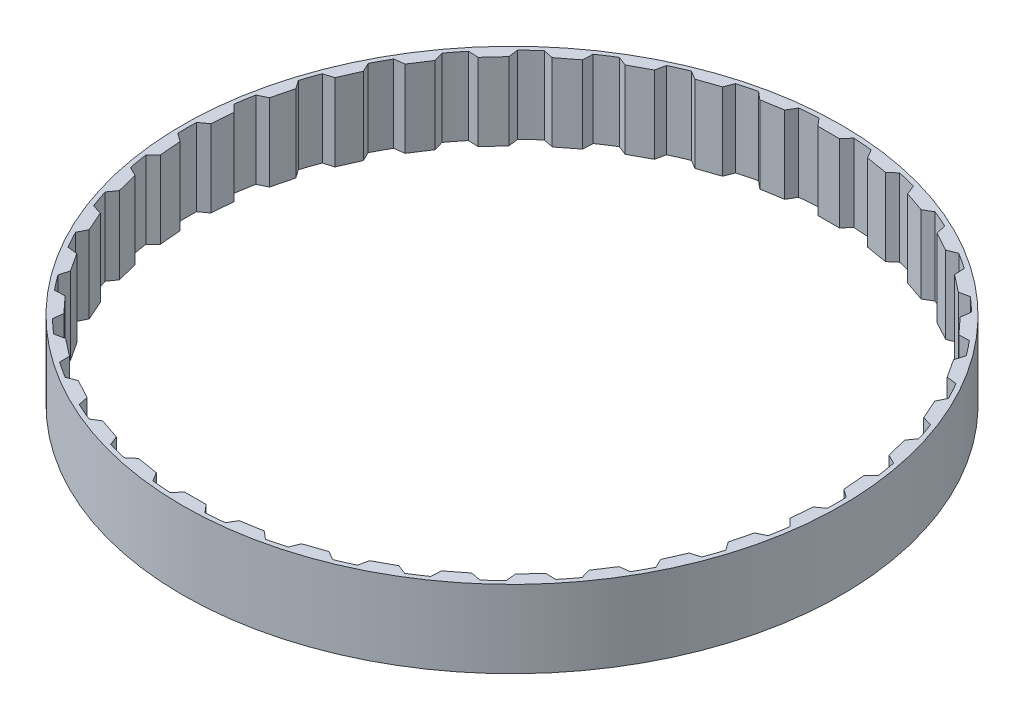
from build123d import *

# Parameters (mm, degrees)
SKETCH_1_R               = 42.6
SKETCH_1_R_2             = 42
EXTRUDE_1_DEPTH          = 10
EXTRUDE_START            = -10
EXTRUDE_2_DEPTH          = 10
PATTERN_CIRCULAR_1_COUNT = 38


with BuildPart() as part:
    # 草图1 → 凸台-拉伸1 (new body)
    with BuildSketch(Plane(origin=(0, 0, 0), x_dir=(1, 0, 0), z_dir=(0, 1, 0))):
        with Locations(Location((0, 0, 0), (0, 0, 270))):
            Circle(SKETCH_1_R)
        with Locations(Location((0, 0, 0), (0, 0, 270))):
            Circle(SKETCH_1_R_2, mode=Mode.SUBTRACT)
    extrude(amount=EXTRUDE_1_DEPTH)

    # 草图2 → 凸台-拉伸2 (add)
    with BuildSketch(Plane(origin=(0, 10, 0), x_dir=(1, 0, 0), z_dir=(0, 1, 0)).offset(EXTRUDE_START)):
        with BuildLine():
            Line((-1.4, 40.93968884), (0, 40.93968884))
            Line((0, 40.93968884), (0, 42))
            ThreePointArc((0, 42), (-1.125404087, 41.984919503), (-2.25, 41.93968884))
            Line((-2.25, 41.93968884), (-1.4, 40.93968884))
        make_face()
        with BuildLine():
            Line((0, 42), (0, 40.93968884))
            Line((0, 40.93968884), (1.4, 40.93968884))
            Line((1.4, 40.93968884), (2.25, 41.93968884))
            ThreePointArc((2.25, 41.93968884), (1.125404087, 41.984919503), (0, 42))
        make_face()
    extrude_2 = extrude(amount=EXTRUDE_2_DEPTH)

    # 阵列(圆周)1: 凸台-拉伸2 ×38 about axis
    pattern_circular_1_axis = Axis((0, 0, 0), (0, 1, 0))
    for i in range(1, PATTERN_CIRCULAR_1_COUNT):
        add(extrude_2.rotate(pattern_circular_1_axis, i * 360 / PATTERN_CIRCULAR_1_COUNT))


solid = part.part
